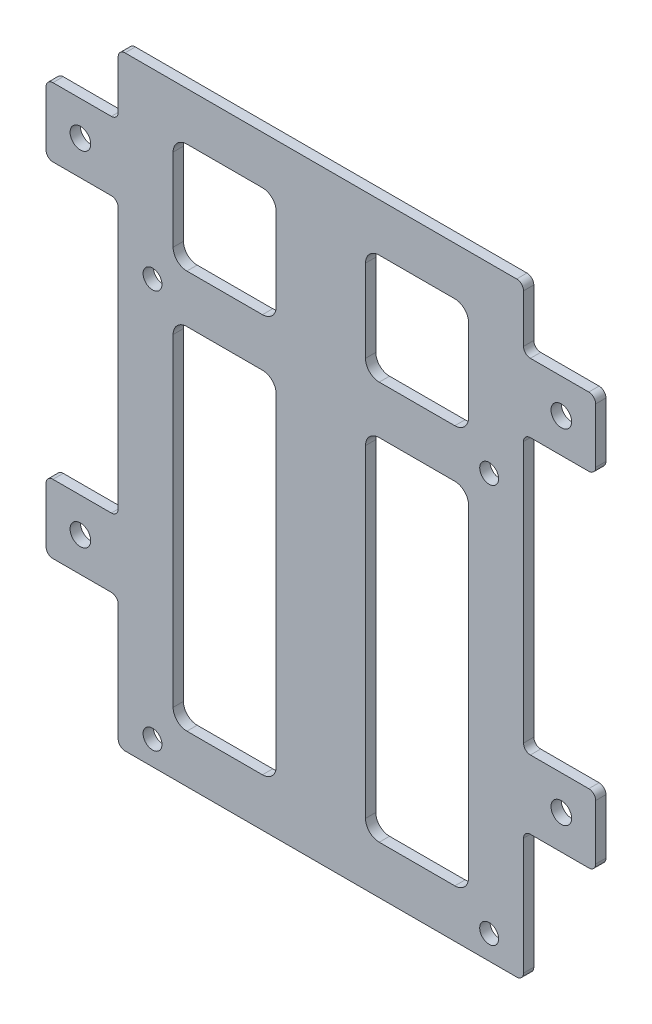
from build123d import *

# Parameters (mm, degrees)
MODEL_R         = 1.375
MODEL_R_2       = 1.5
EXTRUDE_1_DEPTH = 1.5


with BuildPart() as part:
    # Model → Бобышка-Вытянуть1 (new body)
    with BuildSketch(Plane.XY):
        with BuildLine():
            ThreePointArc((-28.5, 7.535944945), (-29.207106781, 7.243051726), (-29.5, 6.535944945))
            Line((-29.5, 6.535944945), (-29.5, -0.464055055))
            ThreePointArc((-29.5, -0.464055055), (-29.792893219, -1.171161836), (-30.5, -1.464055055))
            Line((-30.5, -1.464055055), (-39, -1.464055055))
            ThreePointArc((-39, -1.464055055), (-39.707106781, -1.756948274), (-40, -2.464055055))
            Line((-40, -2.464055055), (-40, -10.464055055))
            ThreePointArc((-40, -10.464055055), (-39.707106781, -11.171161836), (-39, -11.464055055))
            Line((-39, -11.464055055), (-30.5, -11.464055055))
            ThreePointArc((-30.5, -11.464055055), (-29.792893219, -11.756948274), (-29.5, -12.464055055))
            Line((-29.5, -12.464055055), (-29.5, -50.464055055))
            ThreePointArc((-29.5, -50.464055055), (-29.792893219, -51.171161836), (-30.5, -51.464055055))
            Line((-30.5, -51.464055055), (-39, -51.464055055))
            ThreePointArc((-39, -51.464055055), (-39.707106781, -51.756948274), (-40, -52.464055055))
            Line((-40, -52.464055055), (-40, -60.464055055))
            ThreePointArc((-40, -60.464055055), (-39.707106781, -61.171161836), (-39, -61.464055055))
            Line((-39, -61.464055055), (-30.5, -61.464055055))
            ThreePointArc((-30.5, -61.464055055), (-29.792893219, -61.756948274), (-29.5, -62.464055055))
            Line((-29.5, -62.464055055), (-29.5, -79.464055055))
            ThreePointArc((-29.5, -79.464055055), (-29.207106781, -80.171161836), (-28.5, -80.464055055))
            Line((-28.5, -80.464055055), (28.5, -80.464055055))
            ThreePointArc((28.5, -80.464055055), (29.207106781, -80.171161836), (29.5, -79.464055055))
            Line((29.5, -79.464055055), (29.5, -62.464055055))
            ThreePointArc((29.5, -62.464055055), (29.792893219, -61.756948274), (30.5, -61.464055055))
            Line((30.5, -61.464055055), (39, -61.464055055))
            ThreePointArc((39, -61.464055055), (39.707106781, -61.171161836), (40, -60.464055055))
            Line((40, -60.464055055), (40, -52.464055055))
            ThreePointArc((40, -52.464055055), (39.707106781, -51.756948274), (39, -51.464055055))
            Line((39, -51.464055055), (30.5, -51.464055055))
            ThreePointArc((30.5, -51.464055055), (29.792893219, -51.171161836), (29.5, -50.464055055))
            Line((29.5, -50.464055055), (29.5, -12.464055055))
            ThreePointArc((29.5, -12.464055055), (29.792893219, -11.756948274), (30.5, -11.464055055))
            Line((30.5, -11.464055055), (39, -11.464055055))
            ThreePointArc((39, -11.464055055), (39.707106781, -11.171161836), (40, -10.464055055))
            Line((40, -10.464055055), (40, -2.464055055))
            ThreePointArc((40, -2.464055055), (39.707106781, -1.756948274), (39, -1.464055055))
            Line((39, -1.464055055), (30.5, -1.464055055))
            ThreePointArc((30.5, -1.464055055), (29.792893219, -1.171161836), (29.5, -0.464055055))
            Line((29.5, -0.464055055), (29.5, 6.535944945))
            ThreePointArc((29.5, 6.535944945), (29.207106781, 7.243051726), (28.5, 7.535944945))
            Line((28.5, 7.535944945), (-28.5, 7.535944945))
        make_face()
        with Locations((-24.5, -76.964055055)):
            Circle(MODEL_R, mode=Mode.SUBTRACT)
        with Locations((-35, -56.464055055)):
            Circle(MODEL_R_2, mode=Mode.SUBTRACT)
        with BuildLine():
            ThreePointArc((-21.5, -24.464055055), (-20.914213562, -23.049841493), (-19.5, -22.464055055))
            Line((-19.5, -22.464055055), (-8.5, -22.464055055))
            ThreePointArc((-8.5, -22.464055055), (-7.085786438, -23.049841493), (-6.5, -24.464055055))
            Line((-6.5, -24.464055055), (-6.5, -71.464055055))
            ThreePointArc((-6.5, -71.464055055), (-7.085786438, -72.878268617), (-8.5, -73.464055055))
            Line((-8.5, -73.464055055), (-19.5, -73.464055055))
            ThreePointArc((-19.5, -73.464055055), (-20.914213562, -72.878268617), (-21.5, -71.464055055))
            Line((-21.5, -71.464055055), (-21.5, -24.464055055))
        make_face(mode=Mode.SUBTRACT)
        with Locations((-24.5, -18.964055055)):
            Circle(MODEL_R, mode=Mode.SUBTRACT)
        with Locations((-35, -6.464055055)):
            Circle(MODEL_R_2, mode=Mode.SUBTRACT)
        with BuildLine():
            Line((-8.5, -15.464055055), (-19.5, -15.464055055))
            ThreePointArc((-19.5, -15.464055055), (-20.914213562, -14.878268617), (-21.5, -13.464055055))
            Line((-21.5, -13.464055055), (-21.5, -1.464055055))
            ThreePointArc((-21.5, -1.464055055), (-20.914213562, -0.049841493), (-19.5, 0.535944945))
            Line((-19.5, 0.535944945), (-8.5, 0.535944945))
            ThreePointArc((-8.5, 0.535944945), (-7.085786438, -0.049841493), (-6.5, -1.464055055))
            Line((-6.5, -1.464055055), (-6.5, -13.464055055))
            ThreePointArc((-6.5, -13.464055055), (-7.085786438, -14.878268617), (-8.5, -15.464055055))
        make_face(mode=Mode.SUBTRACT)
        with Locations((24.5, -76.964055055)):
            Circle(MODEL_R, mode=Mode.SUBTRACT)
        with BuildLine():
            Line((21.5, -24.464055055), (21.5, -71.464055055))
            ThreePointArc((21.5, -71.464055055), (20.914213562, -72.878268617), (19.5, -73.464055055))
            Line((19.5, -73.464055055), (8.5, -73.464055055))
            ThreePointArc((8.5, -73.464055055), (7.085786438, -72.878268617), (6.5, -71.464055055))
            Line((6.5, -71.464055055), (6.5, -24.464055055))
            ThreePointArc((6.5, -24.464055055), (7.085786438, -23.049841493), (8.5, -22.464055055))
            Line((8.5, -22.464055055), (19.5, -22.464055055))
            ThreePointArc((19.5, -22.464055055), (20.914213562, -23.049841493), (21.5, -24.464055055))
        make_face(mode=Mode.SUBTRACT)
        with Locations((35, -56.464055055)):
            Circle(MODEL_R_2, mode=Mode.SUBTRACT)
        with Locations((24.5, -18.964055055)):
            Circle(MODEL_R, mode=Mode.SUBTRACT)
        with BuildLine():
            ThreePointArc((21.5, -13.464055055), (20.914213562, -14.878268617), (19.5, -15.464055055))
            Line((19.5, -15.464055055), (8.5, -15.464055055))
            ThreePointArc((8.5, -15.464055055), (7.085786438, -14.878268617), (6.5, -13.464055055))
            Line((6.5, -13.464055055), (6.5, -1.464055055))
            ThreePointArc((6.5, -1.464055055), (7.085786438, -0.049841493), (8.5, 0.535944945))
            Line((8.5, 0.535944945), (19.5, 0.535944945))
            ThreePointArc((19.5, 0.535944945), (20.914213562, -0.049841493), (21.5, -1.464055055))
            Line((21.5, -1.464055055), (21.5, -13.464055055))
        make_face(mode=Mode.SUBTRACT)
        with Locations((35, -6.464055055)):
            Circle(MODEL_R_2, mode=Mode.SUBTRACT)
    extrude(amount=EXTRUDE_1_DEPTH)


solid = part.part
